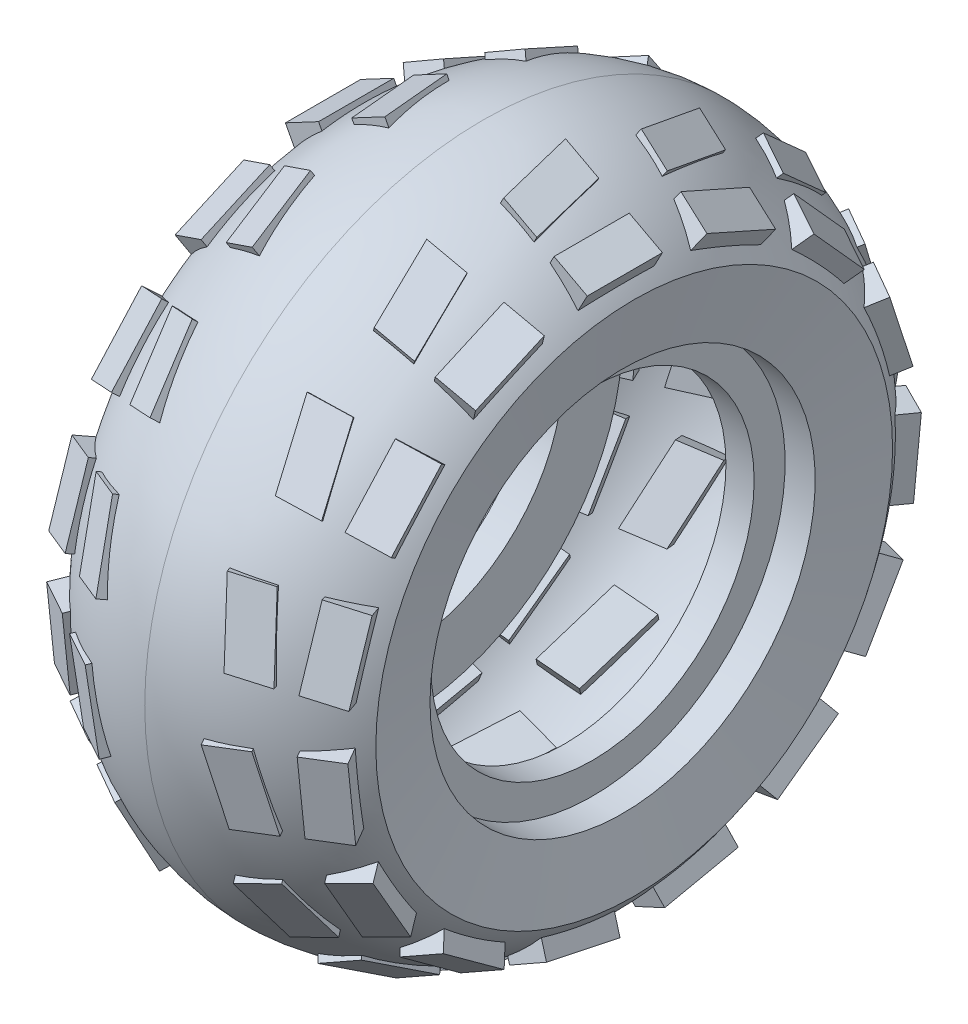
from build123d import *

# Parameters (mm, degrees)
SKETCH3_W           = 4
SKETCH3_H           = 2
BOSS_EXTRUDE5_DEPTH = 3
CIRPATTERN2_COUNT   = 15
SKETCH7_W           = 4
SKETCH7_H           = 2
BOSS_EXTRUDE6_DEPTH = 2.9
CIRPATTERN3_COUNT   = 15
BOSS_EXTRUDE8_DEPTH = 3
CIRPATTERN4_COUNT   = 15
BOSS_EXTRUDE9_DEPTH = 3
CIRPATTERN5_COUNT   = 15


with BuildPart() as part:
    # Sketch1 → Revolve1 (revolve)
    with BuildSketch(Plane.XY, mode=Mode.PRIVATE) as revolve1_sk:
        with BuildLine():
            Line((0, 8.6), (0, 10.25))
            Line((0, 10.25), (-1.6, 10.25))
            Line((-1.6, 10.25), (-2.217144432, 13.75))
            ThreePointArc((-2.217144432, 13.75), (1.294955369, 16.84344527), (5.83, 18))
            ThreePointArc((5.83, 18), (10.365044631, 16.84344527), (13.877144432, 13.75))
            Line((13.877144432, 13.75), (13.26, 10.25))
            Line((13.26, 10.25), (11.66, 10.25))
            Line((11.66, 10.25), (11.66, 8.6))
            Line((11.66, 8.6), (10.16, 8.6))
            Line((10.16, 8.6), (10.16, 11.75))
            Line((10.16, 11.75), (12.001350553, 11.75))
            Line((12.001350553, 11.75), (12.177677534, 12.75))
            ThreePointArc((12.177677534, 12.75), (9.537540973, 15.528405201), (5.83, 16.5))
            ThreePointArc((5.83, 16.5), (2.122459027, 15.528405201), (-0.517677534, 12.75))
            Line((-0.517677534, 12.75), (-0.341350553, 11.75))
            Line((-0.341350553, 11.75), (1.5, 11.75))
            Line((1.5, 11.75), (1.5, 8.6))
            Line((1.5, 8.6), (0, 8.6))
        make_face()
    revolve(revolve1_sk.sketch.rotate(Axis((0, 0, 0), (1, 0, 0)), 90), axis=Axis((0, 0, 0), (1, 0, 0)))

    # Sketch3 → Boss-Extrude5 (add)
    with BuildSketch(Plane(origin=(7.917253267, 14.890187752, 0), x_dir=(0, 0, 1), z_dir=(0.4694715627858798, 0.8829475928589328, 0))):
        with Locations((0.471462434, 4.12447671)):
            Rectangle(SKETCH3_W, SKETCH3_H)
    boss_extrude5 = extrude(amount=BOSS_EXTRUDE5_DEPTH)

    # CirPattern2: Boss-Extrude5 ×15 about axis
    cirpattern2_axis = Axis((0, 0, 0), (1, 0, 0))
    for i in range(1, CIRPATTERN2_COUNT):
        add(boss_extrude5.rotate(cirpattern2_axis, i * 360 / CIRPATTERN2_COUNT))

    # Sketch7 → Boss-Extrude6 (add)
    with BuildSketch(Plane(origin=(-5.347347894, 10.056898704, 0), x_dir=(0, 0, 1), z_dir=(0.46947156278589797, -0.8829475928589232, 0))):
        with Locations((0.311244532, -5.909129471)):
            Rectangle(SKETCH7_W, SKETCH7_H)
    boss_extrude6 = extrude(amount=-BOSS_EXTRUDE6_DEPTH)

    # CirPattern3: Boss-Extrude6 ×15 about axis
    cirpattern3_axis = Axis((0, 0, 0), (1, 0, 0))
    for i in range(1, CIRPATTERN3_COUNT):
        add(boss_extrude6.rotate(cirpattern3_axis, i * 360 / CIRPATTERN3_COUNT))

    # Sketch8 → Boss-Extrude8 (add)
    with BuildSketch(Plane(origin=(-5.347347894, 10.056898704, 0), x_dir=(0, 0, 1), z_dir=(0.46947156278589797, -0.8829475928589232, 0))):
        Polygon((2.311244532, -10.959129471), (-1.688755468, -10.159129471), (-1.688755468, -8.159129471), (2.311244532, -8.959129471), align=None)
    boss_extrude8 = extrude(amount=-BOSS_EXTRUDE8_DEPTH)

    # CirPattern4: Boss-Extrude8 ×15 about axis
    cirpattern4_axis = Axis((0, 0, 0), (1, 0, 0))
    for i in range(1, CIRPATTERN4_COUNT):
        add(boss_extrude8.rotate(cirpattern4_axis, i * 360 / CIRPATTERN4_COUNT))

    # Sketch9 → Boss-Extrude9 (add)
    with BuildSketch(Plane(origin=(7.917253267, 14.890187752, 0), x_dir=(0, 0, 1), z_dir=(0.4694715627858798, 0.8829475928589328, 0))):
        Polygon((2.514251102, 2.136039462), (-1.485748898, 1.336039462), (-1.485748898, -0.663960538), (2.514251102, 0.136039462), align=None)
    boss_extrude9 = extrude(amount=BOSS_EXTRUDE9_DEPTH)

    # CirPattern5: Boss-Extrude9 ×15 about axis
    cirpattern5_axis = Axis((0, 0, 0), (1, 0, 0))
    for i in range(1, CIRPATTERN5_COUNT):
        add(boss_extrude9.rotate(cirpattern5_axis, i * 360 / CIRPATTERN5_COUNT))


solid = part.part
